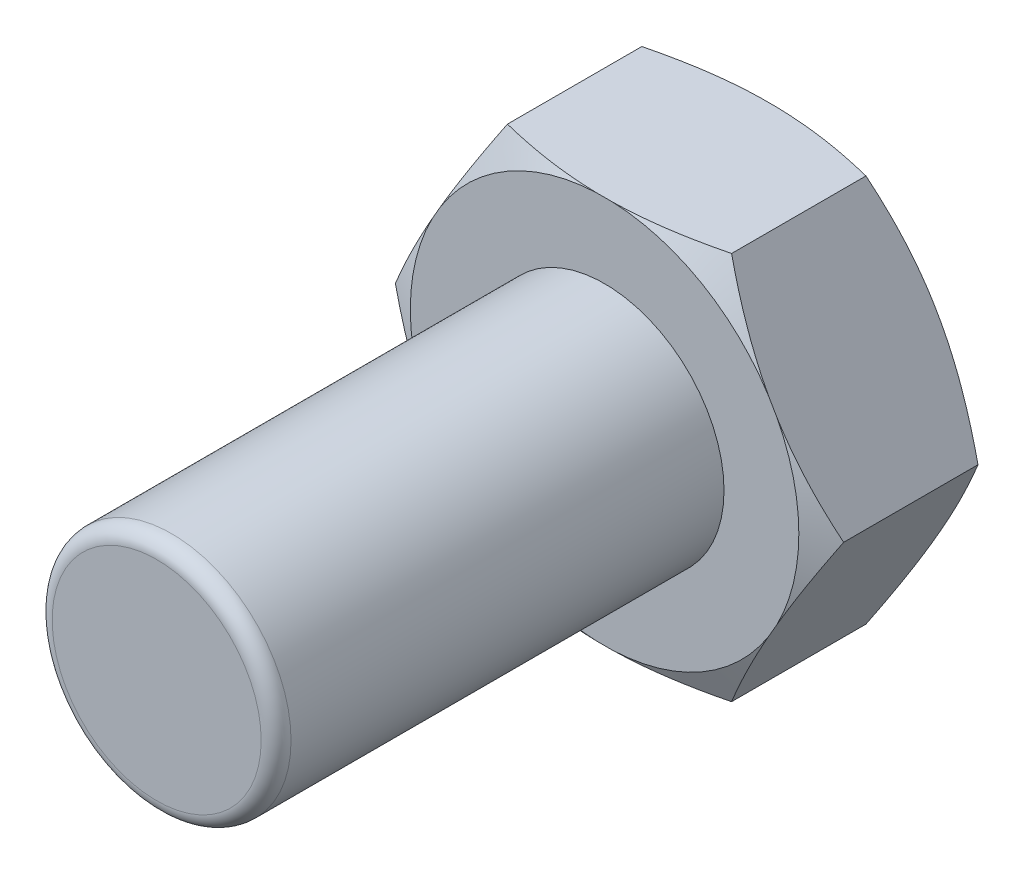
from build123d import *

# Parameters (mm, degrees)
Y_KSEKLIK_EKSTR_ZYON1_DEPTH = 5.5
IZIM2_R                     = 4
Y_KSEKLIK_EKSTR_ZYON2_DEPTH = 15
RADYUS1_R                   = 0.5


with BuildPart() as part:
    # Çizim1 → Yükseklik-Ekstrüzyon1 (new body)
    with BuildSketch(Plane.XY):
        Polygon((7.505553499, 0), (3.75277675, 6.5), (-3.75277675, 6.5), (-7.505553499, 0), (-3.75277675, -6.5), (3.75277675, -6.5), align=None)
    extrude(amount=Y_KSEKLIK_EKSTR_ZYON1_DEPTH)

    # Çizim2 → Yükseklik-Ekstrüzyon2 (add)
    with BuildSketch(Plane.XY.offset(5.5)):
        Circle(IZIM2_R)
    extrude(amount=Y_KSEKLIK_EKSTR_ZYON2_DEPTH)

    # Çizim3 → Kes-Döndür1 (revolve, cut)
    with BuildSketch(Plane(origin=(0, 0, 0), x_dir=(1, 0, 0), z_dir=(0, 1, 0))):
        Polygon((-7.505553499, 0), (-6.505553499, 0), (-7.505553499, -0.5), align=None)
        Polygon((-7.505553499, -5.5), (-7.505553499, -5), (-6.505553499, -5.5), align=None)
    revolve(axis=Axis((0, 0, 0), (0, 0, 1)), mode=Mode.SUBTRACT)

    # Radyus1
    radyus1_edges = [part.edges().sort_by_distance(p)[0] for p in [
        (-4, 0, 20.5),
    ]]
    fillet(radyus1_edges, radius=RADYUS1_R)


solid = part.part
